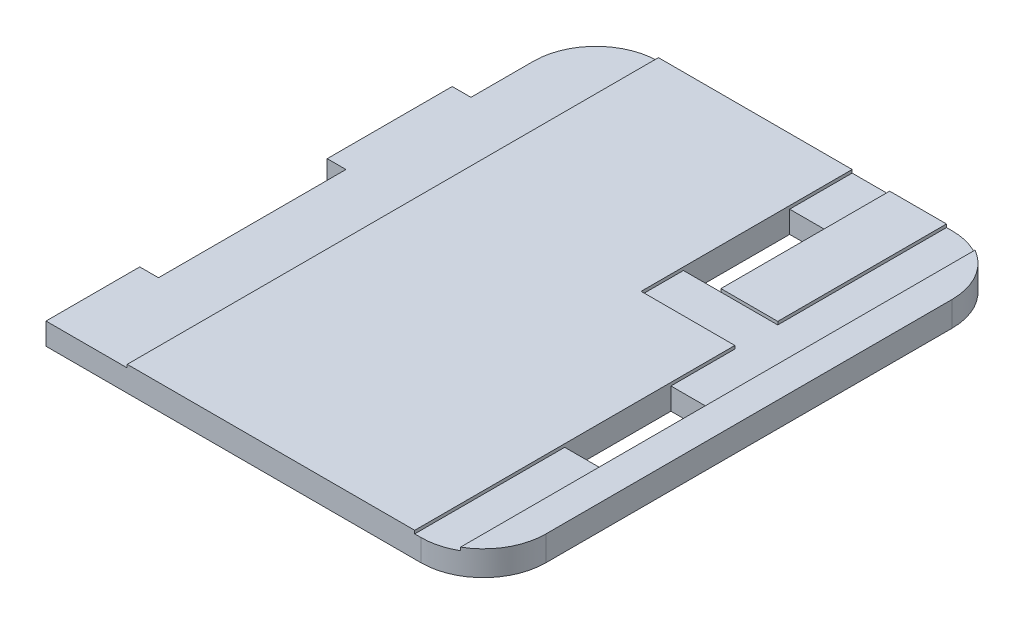
from build123d import *

# Parameters (mm, degrees)
SKETCH1_W           = 0.6
SKETCH1_H           = 1.7
BOSS_EXTRUDE1_DEPTH = 0.4
FILLET2_R           = 1
SKETCH2_W           = 1.780104135
SKETCH2_H           = 8.5
CUT_EXTRUDE1_DEPTH  = 0.05


with BuildPart() as part:
    # Sketch1 → Boss-Extrude1 (new body)
    with BuildSketch(Plane(origin=(0, 0, 0), x_dir=(1, 0, 0), z_dir=(0, 1, 0))):
        Polygon((0, 0), (7, 0), (7, 8.5), (0.3, 8.5), (0.3, 6.5), (0, 6.5), (0, 4.5), (0.3, 4.5), (0.3, 1.5), (0, 1.5), align=None)
        with Locations((4.7, 6.65)):
            Rectangle(SKETCH1_W, SKETCH1_H, mode=Mode.SUBTRACT)
        with Locations((6.2, 3.25)):
            Rectangle(SKETCH1_W, SKETCH1_H, mode=Mode.SUBTRACT)
    extrude(amount=BOSS_EXTRUDE1_DEPTH)

    # Fillet2
    fillet2_edges = [part.edges().sort_by_distance(p)[0] for p in [
        (0.3, 0.2, -8.5),
        (7, 0.2, -8.5),
        (7, 0.2, 0),
    ]]
    fillet(fillet2_edges, radius=FILLET2_R)

    # Sketch2 → Cut-Extrude1 (cut)
    with BuildSketch(Plane(origin=(0, 0.4, 0), x_dir=(1, 0, 0), z_dir=(0, 1, 0))):
        with Locations((0.409947933, 4.25)):
            Rectangle(SKETCH2_W, SKETCH2_H)
        Polygon((4.4, 7.5), (4.4, 8.794208179), (5, 8.794208179), (5, 7.5), (5, 5.8), (5.909455283, 5.8), (5.909455283, 8.5), (6.5, 8.5), (6.5, 5.123047138), (6.5, 4.1), (6.5, 0), (5.9, 0), (5.9, 4.1), (5.9, 5.123047138), (4.4, 5.123047138), align=None)
    extrude(amount=-CUT_EXTRUDE1_DEPTH, mode=Mode.SUBTRACT)


solid = part.part
